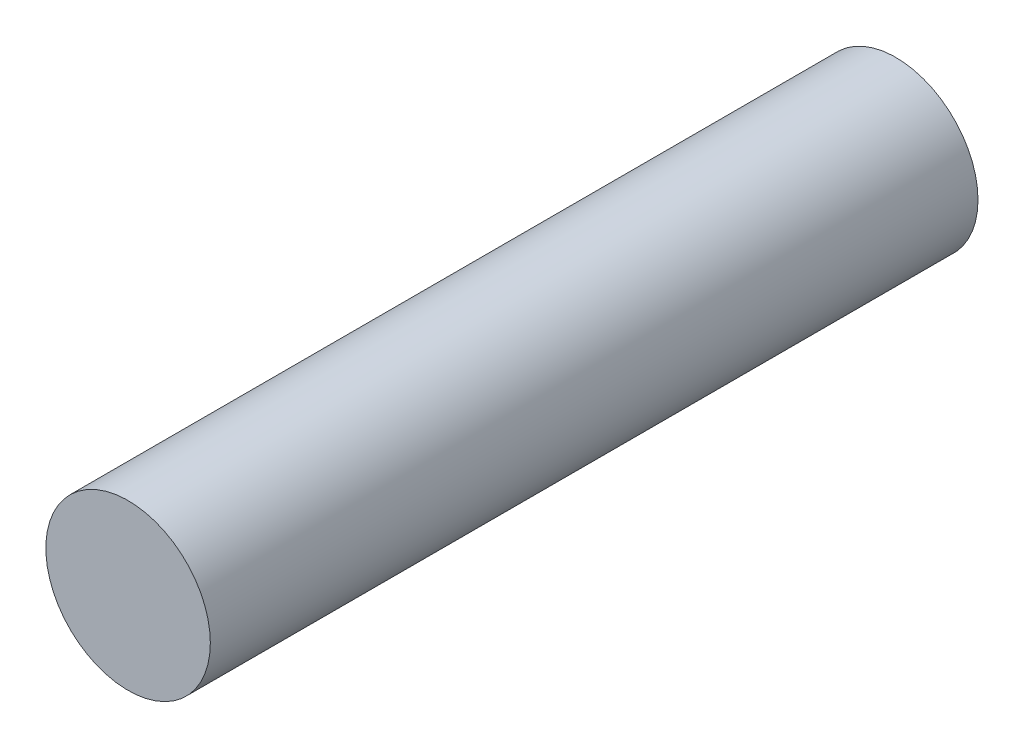
from build123d import *

# Parameters (mm, degrees)
ESQUISSE1_R        = 7.5
BOSS_EXTRU_1_DEPTH = 70


with BuildPart() as part:
    # Esquisse1 → Boss.-Extru.1 (new body)
    with BuildSketch(Plane.XY):
        Circle(ESQUISSE1_R)
    extrude(amount=BOSS_EXTRU_1_DEPTH)


solid = part.part
